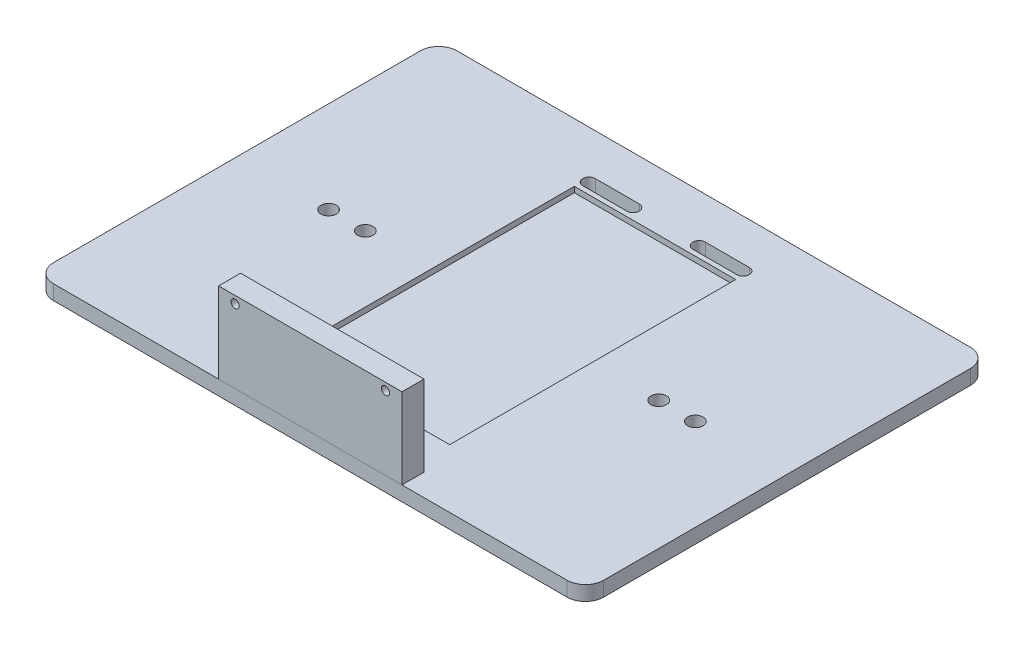
from build123d import *

# Parameters (mm, degrees)
SKETCH1_W           = 150
SKETCH1_H           = 110
BOSS_EXTRUDE1_DEPTH = 4
FILLET1_R           = 5
SKETCH2_R           = 2.1
CUT_EXTRUDE1_DEPTH  = 94.091352982
SKETCH3_R           = 3
BOSS_EXTRUDE2_DEPTH = 2
CUT_EXTRUDE2_DEPTH  = 1.5
SKETCH7_W           = 50
SKETCH7_H           = 22
BOSS_EXTRUDE4_DEPTH = 6
SKETCH8_R           = 1.1
CUT_EXTRUDE3_DEPTH  = 131.831953284
CUT_EXTRUDE4_DEPTH  = 97.571217244
SKETCH10_R          = 2.1
CUT_EXTRUDE5_DEPTH  = 96.571962416


with BuildPart() as part:
    # Sketch1 → Boss-Extrude1 (new body)
    with BuildSketch(Plane(origin=(0, 0, 0), x_dir=(1, 0, 0), z_dir=(0, 1, 0))):
        Rectangle(SKETCH1_W, SKETCH1_H)
    extrude(amount=BOSS_EXTRUDE1_DEPTH)

    # Fillet1
    fillet1_edges = [part.edges().sort_by_distance(p)[0] for p in [
        (75, 2, 55),
        (-75, 2, 55),
        (-75, 2, -55),
        (75, 2, -55),
    ]]
    fillet(fillet1_edges, radius=FILLET1_R)

    # Sketch2 → Cut-Extrude1 (cut, through all)
    with BuildSketch(Plane(origin=(0, 4, 0), x_dir=(1, 0, 0), z_dir=(0, 1, 0))):
        with Locations(Location((-50, 0, 0), (0, 0, 270))):
            Circle(SKETCH2_R)
        with Locations(Location((-40, 0, 0), (0, 0, 270))):
            Circle(SKETCH2_R)
    cut_extrude1 = extrude(amount=-CUT_EXTRUDE1_DEPTH, mode=Mode.SUBTRACT)

    # Sketch3 → Boss-Extrude2 (add)
    with BuildSketch(Plane.XZ):
        with Locations(Location((-50, 0, 0), (0, 0, 270))):
            Circle(SKETCH3_R)
        with Locations(Location((-40, 0, 0), (0, 0, 270))):
            Circle(SKETCH3_R)
    boss_extrude2 = extrude(amount=BOSS_EXTRUDE2_DEPTH)

    # Mirror1: Cut-Extrude1, Boss-Extrude2 across plane
    add(cut_extrude1.mirror(Plane(origin=(0, 0, 0), x_dir=(0, 0, 1), z_dir=(1, 0, 0))), mode=Mode.SUBTRACT)
    add(boss_extrude2.mirror(Plane(origin=(0, 0, 0), x_dir=(0, 0, 1), z_dir=(1, 0, 0))))

    # Sketch4 → Cut-Extrude2 (cut)
    with BuildSketch(Plane(origin=(0, 4, 0), x_dir=(1, 0, 0), z_dir=(0, 1, 0))):
        Polygon((-22, -39), (-6, -39), (-6, -43), (6, -43), (6, -39), (22, -39), (22, 39), (-22, 39), align=None)
    extrude(amount=-CUT_EXTRUDE2_DEPTH, mode=Mode.SUBTRACT)

    # Sketch9 → Cut-Extrude4 (cut, through all)
    with BuildSketch(Plane.XZ):
        with BuildLine():
            Line((-21, -40.3), (-9, -40.3))
            ThreePointArc((-9, -40.3), (-7.3, -42), (-9, -43.7))
            Line((-9, -43.7), (-21, -43.7))
            ThreePointArc((-21, -43.7), (-22.7, -42), (-21, -40.3))
        make_face()
        with BuildLine():
            Line((21, -40.3), (9, -40.3))
            ThreePointArc((9, -40.3), (7.3, -42), (9, -43.7))
            Line((9, -43.7), (21, -43.7))
            ThreePointArc((21, -43.7), (22.7, -42), (21, -40.3))
        make_face()
    extrude(amount=-CUT_EXTRUDE4_DEPTH, mode=Mode.SUBTRACT)

    # Sketch10 → Cut-Extrude5 (cut, through all)
    with BuildSketch(Plane(origin=(0, 4, 0), x_dir=(1, 0, 0), z_dir=(0, 1, 0))):
        with Locations(Location((-50, 0, 0), (0, 0, 270))):
            Circle(SKETCH10_R)
        with Locations(Location((-40, 0, 0), (0, 0, 270))):
            Circle(SKETCH10_R)
        with Locations(Location((40, 0, 0), (0, 0, 270))):
            Circle(SKETCH10_R)
        with Locations(Location((50, 0, 0), (0, 0, 270))):
            Circle(SKETCH10_R)
    extrude(amount=-CUT_EXTRUDE5_DEPTH, mode=Mode.SUBTRACT)


with BuildPart() as body_2:
    # Sketch7 → Boss-Extrude4 (new body)
    with BuildSketch(Plane.XY.offset(55)):
        with Locations((0, 15)):
            Rectangle(SKETCH7_W, SKETCH7_H)
    extrude(amount=-BOSS_EXTRUDE4_DEPTH)

    # Sketch8 → Cut-Extrude3 (cut, through all)
    with BuildSketch(Plane(origin=(0, 0, 49), x_dir=(-1, 0, 0), z_dir=(0, 0, -1))):
        with Locations((-20.5, 24)):
            Circle(SKETCH8_R)
        with Locations(Location((20.5, 24, 0), (0, 0, 180))):
            Circle(SKETCH8_R)
    extrude(amount=-CUT_EXTRUDE3_DEPTH, mode=Mode.SUBTRACT)


solid = Compound([part.part, body_2.part])
